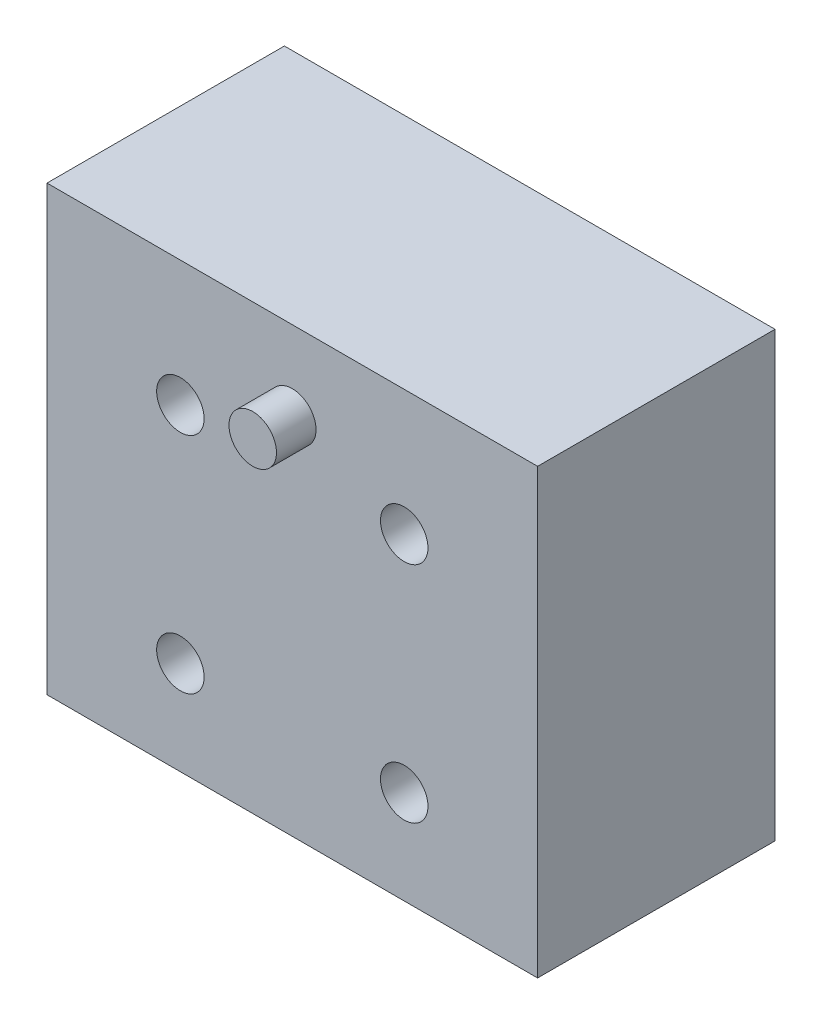
from build123d import *

# Parameters (mm, degrees)
ESBO_O1_R                = 60
ESBO_O1_R_2              = 3
RESSALTO_EXTRUS_O4_DEPTH = 30
ESBO_O6_R                = 60
ESBO_O6_R_2              = 5
RESSALTO_EXTRUS_O8_DEPTH = 30
ESBO_O9_R                = 60
CORTE_EXTRUS_O1_DEPTH    = 91
ESBO_O11_W               = 62
ESBO_O11_H               = 15
CORTE_EXTRUS_O2_DEPTH    = 60.514704065
ESBO_O12_R               = 2.5
CORTE_EXTRUS_O3_DEPTH    = 15
ESBO_O15_R               = 3
RESSALTO_EXTRUS_O9_DEPTH = 5
ESBO_O16_R               = 4.75
CORTE_EXTRUS_O4_DEPTH    = 6


with BuildPart() as part:
    # Esboço1 → Ressalto-extrusão4 (new body)
    with BuildSketch(Plane.XY):
        Circle(ESBO_O1_R)
        with Locations((-14.142135624, 14.142135624)):
            Circle(ESBO_O1_R_2, mode=Mode.SUBTRACT)
        with Locations((14.142135624, 14.142135624)):
            Circle(ESBO_O1_R_2, mode=Mode.SUBTRACT)
        with Locations((14.142135624, -14.142135624)):
            Circle(ESBO_O1_R_2, mode=Mode.SUBTRACT)
        with Locations((-14.142135624, -14.142135624)):
            Circle(ESBO_O1_R_2, mode=Mode.SUBTRACT)
        with Locations((0, 20)):
            Circle(ESBO_O1_R_2, mode=Mode.SUBTRACT)
    extrude(amount=-RESSALTO_EXTRUS_O4_DEPTH)

    # Esboço6 → Ressalto-extrusão8 (add)
    with BuildSketch(Plane.XY):
        Circle(ESBO_O6_R)
        with Locations((-14.142135624, -14.142135624)):
            Circle(ESBO_O6_R_2, mode=Mode.SUBTRACT)
        with Locations((14.142135624, -14.142135624)):
            Circle(ESBO_O6_R_2, mode=Mode.SUBTRACT)
        with Locations((-14.142135624, 14.142135624)):
            Circle(ESBO_O6_R_2, mode=Mode.SUBTRACT)
        with Locations((14.142135624, 14.142135624)):
            Circle(ESBO_O6_R_2, mode=Mode.SUBTRACT)
    extrude(amount=-RESSALTO_EXTRUS_O8_DEPTH)

    # Esboço9 → Corte-extrusão1 (cut, through all)
    with BuildSketch(Plane(origin=(0, 0, -30), x_dir=(-1, 0, 0), z_dir=(0, 0, -1))):
        Circle(ESBO_O9_R)
        Polygon((-31, 30), (0, 30), (31, 30), (31, 0), (31, -31), (31, -41), (-31, -41), (-31, -31), (-31, 0), align=None, mode=Mode.SUBTRACT)
    extrude(amount=-CORTE_EXTRUS_O1_DEPTH, mode=Mode.SUBTRACT)

    # Esboço11 → Corte-extrusão2 (cut, through all)
    with BuildSketch(Plane.XY):
        with Locations((0, -33.5)):
            Rectangle(ESBO_O11_W, ESBO_O11_H)
    extrude(amount=-CORTE_EXTRUS_O2_DEPTH, mode=Mode.SUBTRACT)

    # Esboço12 → Corte-extrusão3 (cut)
    with BuildSketch(Plane.XZ.offset(26)):
        with Locations(Location((24.07, -15, 0), (0, 0, 270))):
            Circle(ESBO_O12_R)
        with Locations(Location((0, -15, 0), (0, 0, 270))):
            Circle(ESBO_O12_R)
        with Locations(Location((-24.07, -15, 0), (0, 0, 270))):
            Circle(ESBO_O12_R)
    extrude(amount=-CORTE_EXTRUS_O3_DEPTH, mode=Mode.SUBTRACT)

    # Esboço15 → Ressalto-extrusão9 (add)
    with BuildSketch(Plane.XY):
        with Locations((0, 20)):
            Circle(ESBO_O15_R)
    extrude(amount=RESSALTO_EXTRUS_O9_DEPTH)

    # Esboço16 → Corte-extrusão4 (cut)
    with BuildSketch(Plane(origin=(0, 0, -30), x_dir=(-1, 0, 0), z_dir=(0, 0, -1))):
        with Locations((14.142135624, 14.142135624)):
            Circle(ESBO_O16_R)
        with Locations((14.142135624, -14.142135624)):
            Circle(ESBO_O16_R)
        with Locations((-14.142135624, 14.142135624)):
            Circle(ESBO_O16_R)
        with Locations((-14.142135624, -14.142135624)):
            Circle(ESBO_O16_R)
    extrude(amount=-CORTE_EXTRUS_O4_DEPTH, mode=Mode.SUBTRACT)


solid = part.part
